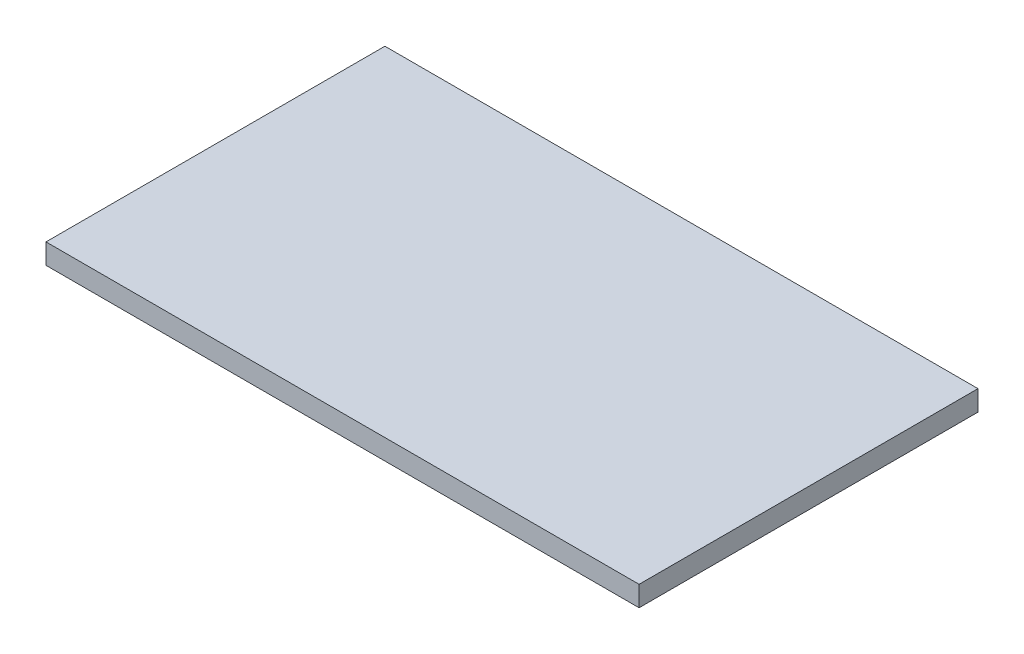
from build123d import *

# Parameters (mm, degrees)
SKETCH1_W           = 175
SKETCH1_H           = 100
BOSS_EXTRUDE1_DEPTH = 6


with BuildPart() as part:
    # Sketch1 → Boss-Extrude1 (new body)
    with BuildSketch(Plane(origin=(0, 0, 0), x_dir=(1, 0, 0), z_dir=(0, 1, 0))):
        with Locations((87.5, 50)):
            Rectangle(SKETCH1_W, SKETCH1_H)
    extrude(amount=BOSS_EXTRUDE1_DEPTH)


solid = part.part
